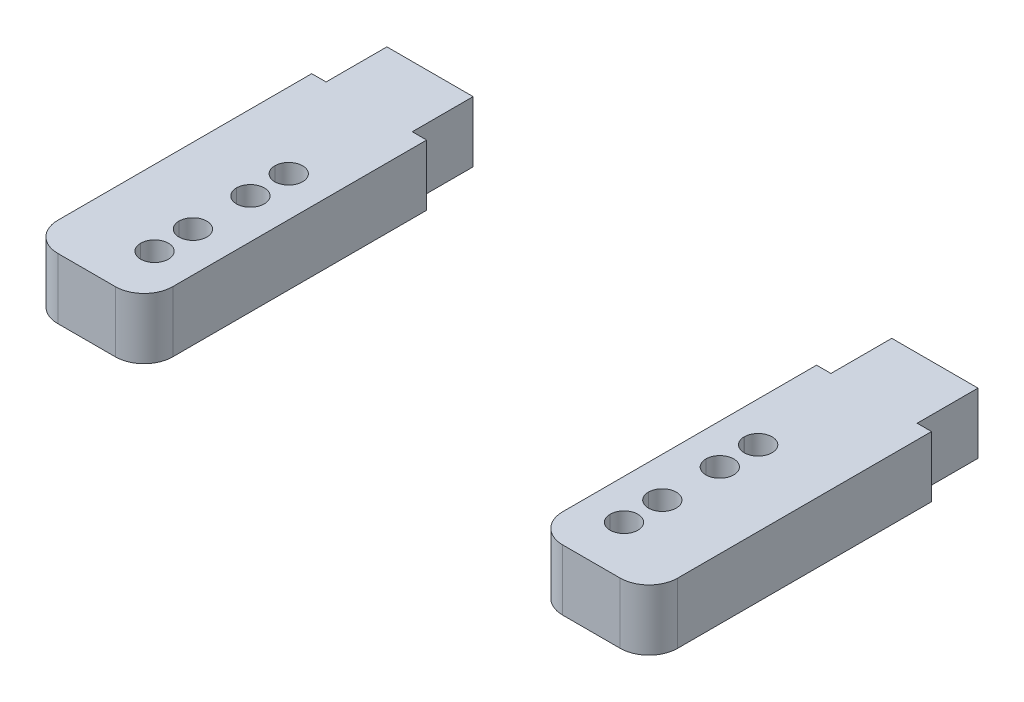
from build123d import *

# Parameters (mm, degrees)
BOSS_EXTRUDE1_DEPTH   = 6.35
BOSS_EXTRUDE1_2_DEPTH = 6.35
FILLET1_R             = 3
FILLET2_R             = 3


with BuildPart() as part:
    # Sketch1 → Boss-Extrude1 (new body)
    with BuildSketch(Plane(origin=(0, 0, 0), x_dir=(1, 0, 0), z_dir=(0, 1, 0))):
        Polygon((-32.35, -10.25), (-20.35, -10.25), (-20.35, 19.25), (-21.85, 19.25), (-21.85, 25.6), (-30.85, 25.6), (-30.85, 19.25), (-32.35, 19.25), align=None)
        with BuildLine():
            ThreePointArc((-25.95, 4.9995), (-24.5, 3.5495), (-23.05, 4.9995))
            ThreePointArc((-23.05, 4.9995), (-24.5, 6.4505), (-25.95, 4.9995))
        make_face(mode=Mode.SUBTRACT)
        with BuildLine():
            ThreePointArc((-25.95, -5.0005), (-24.5, -6.4505), (-23.05, -5.0005))
            ThreePointArc((-23.05, -5.0005), (-24.5, -3.5495), (-25.95, -5.0005))
        make_face(mode=Mode.SUBTRACT)
        with BuildLine():
            ThreePointArc((-25.95, -1.0005), (-24.5, -2.4505), (-23.05, -1.0005))
            ThreePointArc((-23.05, -1.0005), (-24.5, 0.4505), (-25.95, -1.0005))
        make_face(mode=Mode.SUBTRACT)
        with BuildLine():
            ThreePointArc((-25.95, 8.9995), (-24.5, 7.5495), (-23.05, 8.9995))
            ThreePointArc((-23.05, 8.9995), (-24.5, 10.4505), (-25.95, 8.9995))
        make_face(mode=Mode.SUBTRACT)
    extrude(amount=BOSS_EXTRUDE1_DEPTH)

    # Fillet1
    fillet1_edges = [part.edges().sort_by_distance(p)[0] for p in [
        (-20.35, 3.175, 10.25),
        (-32.35, 3.175, 10.25),
    ]]
    fillet(fillet1_edges, radius=FILLET1_R)


with BuildPart() as body_2:
    # Sketch1 → Boss-Extrude1 2 (new body)
    with BuildSketch(Plane(origin=(0, 0, 0), x_dir=(1, 0, 0), z_dir=(0, 1, 0))):
        Polygon((21.85, 19.25), (21.85, 25.6), (30.85, 25.6), (30.85, 19.25), (32.35, 19.25), (32.35, -10.25), (20.35, -10.25), (20.35, 19.25), align=None)
        with BuildLine():
            Line((23.05, -5.0005), (23.05, -4.9995))
            ThreePointArc((23.05, -4.9995), (24.5, -3.5495), (25.95, -5.0005))
            ThreePointArc((25.95, -5.0005), (24.5, -6.4505), (23.05, -5.0005))
        make_face(mode=Mode.SUBTRACT)
        with BuildLine():
            ThreePointArc((25.95, 4.9995), (24.5, 3.5495), (23.05, 4.9995))
            ThreePointArc((23.05, 4.9995), (24.5, 6.4505), (25.95, 4.9995))
        make_face(mode=Mode.SUBTRACT)
        with BuildLine():
            ThreePointArc((25.95, 8.9995), (24.5, 7.5495), (23.05, 8.9995))
            ThreePointArc((23.05, 8.9995), (24.5, 10.4505), (25.95, 8.9995))
        make_face(mode=Mode.SUBTRACT)
        with BuildLine():
            ThreePointArc((25.95, -1.0005), (24.5, -2.4505), (23.05, -1.0005))
            ThreePointArc((23.05, -1.0005), (24.5, 0.4505), (25.95, -1.0005))
        make_face(mode=Mode.SUBTRACT)
    extrude(amount=BOSS_EXTRUDE1_2_DEPTH)

    # Fillet2
    fillet2_edges = [body_2.edges().sort_by_distance(p)[0] for p in [
        (32.35, 3.175, 10.25),
        (20.35, 3.175, 10.25),
    ]]
    fillet(fillet2_edges, radius=FILLET2_R)


solid = Compound([part.part, body_2.part])
